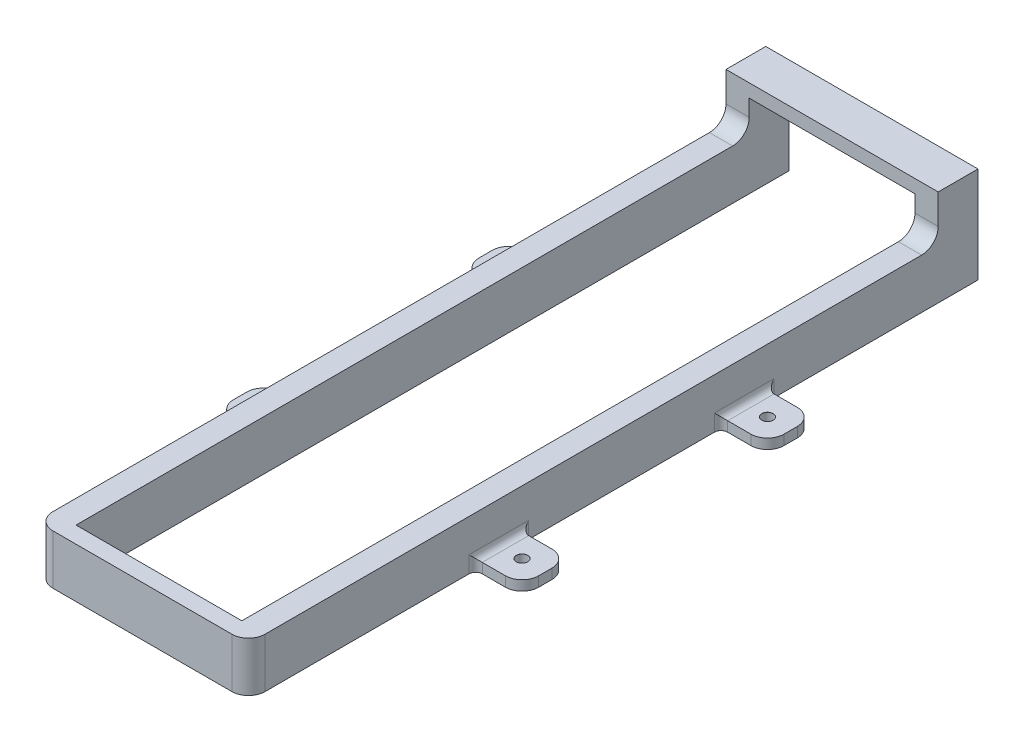
from build123d import *

# Parameters (mm, degrees)
BOSS_EXTRUDE1_DEPTH            = 7.5
SKETCH2_W                      = 10
SKETCH2_H                      = 10
BOSS_EXTRUDE2_DEPTH            = 12
CUT_EXTRUDE1_DEPTH             = 124.51619327
CUT_EXTRUDE1_DEPTH_BACK        = 124.51619327
SKETCH4_W                      = 14
SKETCH4_H                      = 14
BOSS_EXTRUDE3_DEPTH            = 15
SKETCH7_W                      = 14
SKETCH7_H                      = 14
CUT_EXTRUDE2_DEPTH             = 12
M3_CLEARANCE_HOLE1_D           = 3.4
M3_CLEARANCE_HOLE1_CSINK_D     = 3.45
M3_CLEARANCE_HOLE1_CSINK_ANGLE = 90
FILLET1_R                      = 2
FILLET2_R                      = 5


with BuildPart() as part:
    # Sketch1 → Boss-Extrude1 (new, symmetric)
    with BuildSketch(Plane(origin=(0, 0, 0), x_dir=(1, 0, 0), z_dir=(0, 1, 0))):
        Polygon((25, 107.5), (35, 107.5), (35, -117.5), (-35, -117.5), (-35, 107.5), (-25, 107.5), (-25, -107.5), (25, -107.5), align=None)
    extrude(amount=BOSS_EXTRUDE1_DEPTH, both=True)

    # Sketch2 → Boss-Extrude2 (add)
    with BuildSketch(Plane(origin=(0, 0, -107.5), x_dir=(-1, 0, 0), z_dir=(0, 0, -1))):
        with Locations((-30, 12.5)):
            Rectangle(SKETCH2_W, SKETCH2_H)
        Polygon((-35, 21.5), (-35, 17.5), (-25, 17.5), (25, 17.5), (35, 17.5), (35, 21.5), align=None)
        with Locations((30, 12.5)):
            Rectangle(SKETCH2_W, SKETCH2_H)
    extrude(amount=-BOSS_EXTRUDE2_DEPTH)

    # Sketch3 → Cut-Extrude1 (cut, two sides: drawn at the far end of the back side and taken through both)
    with BuildSketch(Plane(origin=(0, 7.5, 0), x_dir=(1, 0, 0), z_dir=(0, 1, 0)).offset(-CUT_EXTRUDE1_DEPTH_BACK)):
        Polygon((-35, -117.5), (35, -117.5), (35, -112.5), (35, 107.5), (32, 107.5), (32, -112.5), (-32, -112.5), (-32, 107.5), (-35, 107.5), (-35, -112.5), align=None)
    extrude(amount=CUT_EXTRUDE1_DEPTH + CUT_EXTRUDE1_DEPTH_BACK, mode=Mode.SUBTRACT)

    # Sketch4 → Boss-Extrude3 (add)
    with BuildSketch(Plane(origin=(0, 7.5, 0), x_dir=(1, 0, 0), z_dir=(0, 1, 0))):
        with Locations((-39, 37)):
            Rectangle(SKETCH4_W, SKETCH4_H)
        with Locations((39, -37)):
            Rectangle(SKETCH4_W, SKETCH4_H)
        with Locations((-39, -37)):
            Rectangle(SKETCH4_W, SKETCH4_H)
        with Locations((39, 37)):
            Rectangle(SKETCH4_W, SKETCH4_H)
    extrude(amount=-BOSS_EXTRUDE3_DEPTH)

    # Sketch7 → Cut-Extrude2 (cut)
    with BuildSketch(Plane(origin=(0, 7.5, 0), x_dir=(1, 0, 0), z_dir=(0, 1, 0))):
        with Locations((-39, 37)):
            Rectangle(SKETCH7_W, SKETCH7_H)
        with Locations((39, 37)):
            Rectangle(SKETCH7_W, SKETCH7_H)
        with Locations((39, -37)):
            Rectangle(SKETCH7_W, SKETCH7_H)
        with Locations((-39, -37)):
            Rectangle(SKETCH7_W, SKETCH7_H)
    extrude(amount=-CUT_EXTRUDE2_DEPTH, mode=Mode.SUBTRACT)

    # M3 Clearance Hole1 (through all)
    with Locations(Plane(origin=(0, -4.5, 0), x_dir=(1, 0, 0), z_dir=(0, 1, 0))):
        with Locations((-39, 37), (39, 37), (39, -37), (-39, -37)):
            CounterSinkHole(M3_CLEARANCE_HOLE1_D / 2, M3_CLEARANCE_HOLE1_CSINK_D / 2, counter_sink_angle=M3_CLEARANCE_HOLE1_CSINK_ANGLE)

    # Fillet1
    fillet1_edges = [part.edges().sort_by_distance(p)[0] for p in [
        (-32, -6, -44),
        (-32, -6, -30),
        (-32, -6, 30),
        (-32, -6, 44),
        (32, -6, 30),
        (32, -6, 44),
        (32, -6, -44),
        (32, -6, -30),
        (-32, -4.5, 37),
        (32, -4.5, 37),
        (32, -4.5, -37),
        (-32, -4.5, -37),
    ]]
    fillet(fillet1_edges, radius=FILLET1_R)

    # Fillet2
    fillet2_edges = [part.edges().sort_by_distance(p)[0] for p in [
        (-46, -6, -30),
        (-46, -6, -44),
        (-46, -6, 44),
        (-46, -6, 30),
        (46, -6, 30),
        (46, -6, 44),
        (46, -6, -44),
        (46, -6, -30),
        (-28.5, 7.5, -95.5),
        (28.5, 7.5, -95.5),
        (-32, 0, 112.5),
        (32, 0, 112.5),
    ]]
    fillet(fillet2_edges, radius=FILLET2_R)


solid = part.part
